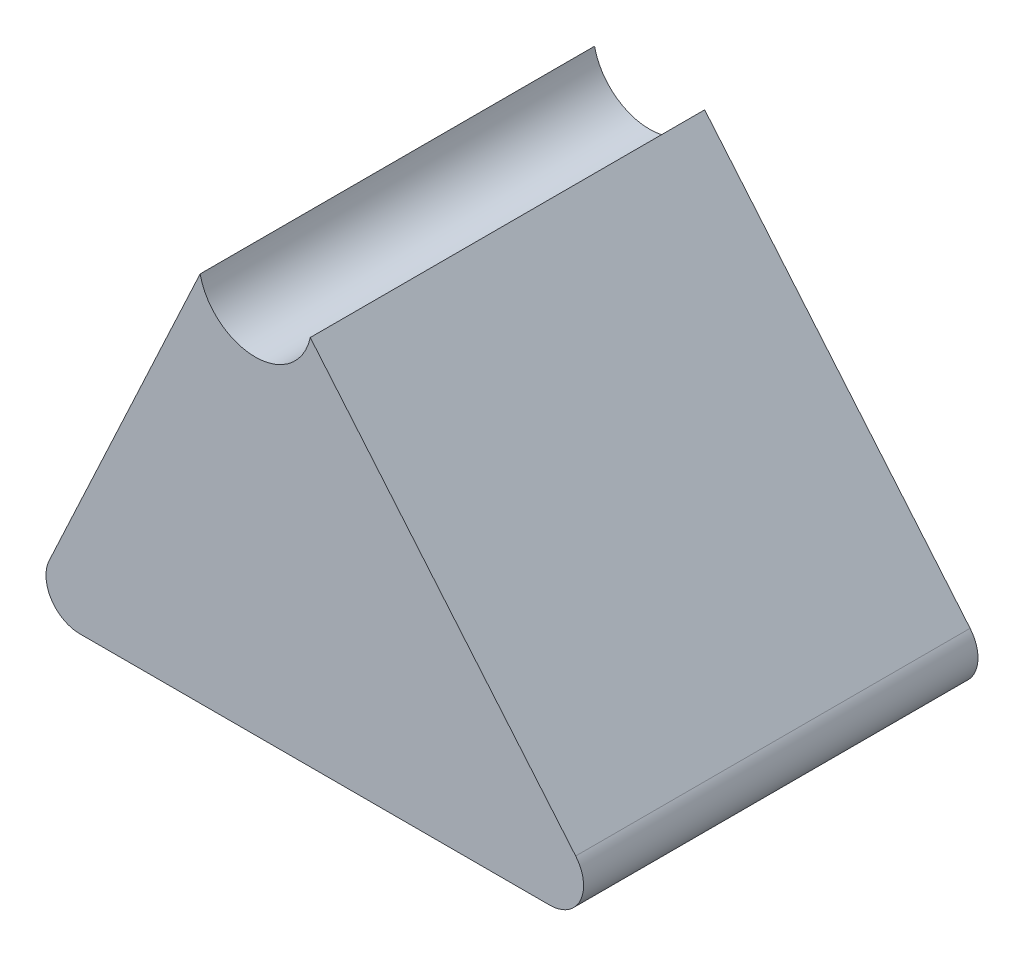
from build123d import *

# Parameters (mm, degrees)
EXTRUDE_1_DEPTH = 35
FILLET_1_R      = 3


with BuildPart() as part:
    # 스케치1 → 보스-돌출1 (new body)
    with BuildSketch(Plane.XY):
        with BuildLine():
            Line((0, 0), (52.851450041, 0))
            Line((52.851450041, 0), (25.161162212, 33))
            ThreePointArc((25.161162212, 33), (20.274657466, 29.059278699), (15.388152719, 33))
            Line((15.388152719, 33), (0, 0))
        make_face()
    extrude(amount=EXTRUDE_1_DEPTH)

    # 필렛1
    fillet_1_edges = [part.edges().sort_by_distance(p)[0] for p in [
        (52.851450041, 0, 17.5),
        (0, 0, 17.5),
    ]]
    fillet(fillet_1_edges, radius=FILLET_1_R)


solid = part.part
